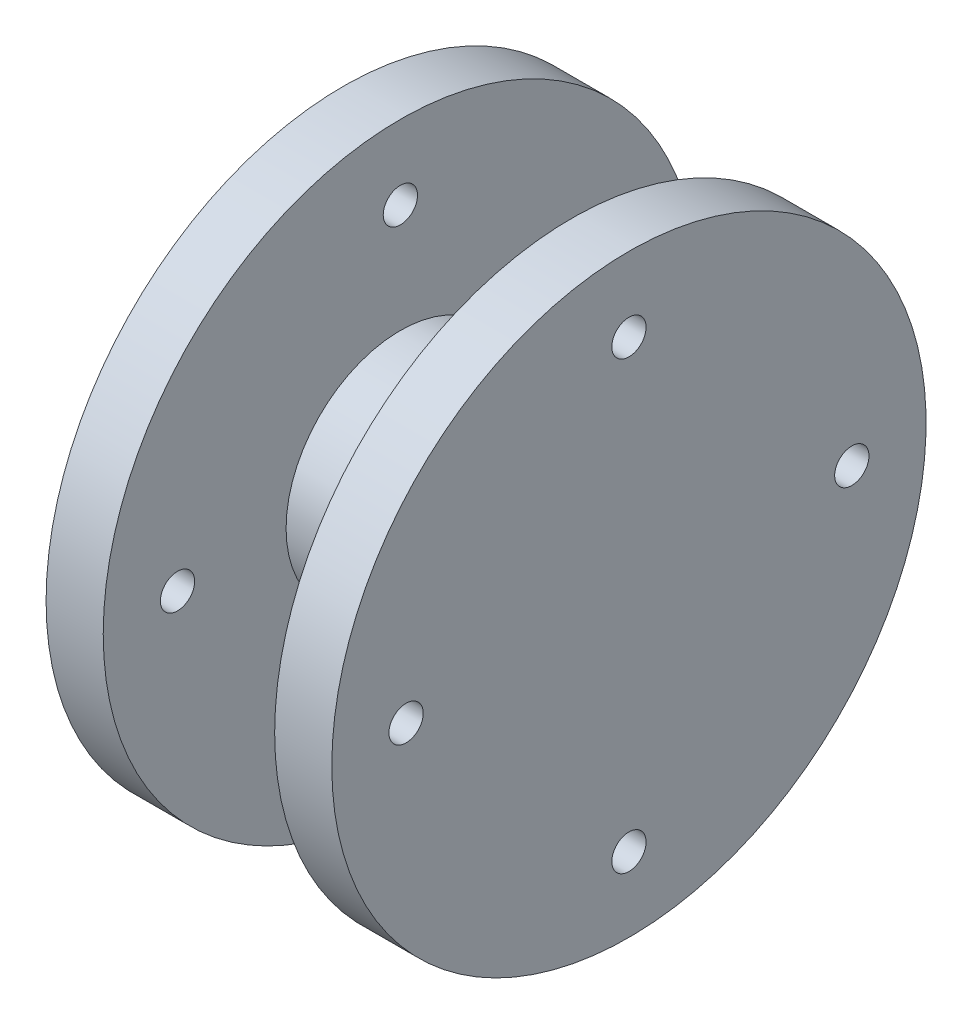
from build123d import *

# Parameters (mm, degrees)
SKETCH_2_R               = 1.5
CUT_EXTRUDE_1_DEPTH      = 45.463468151
PATTERN_CIRCULAR_1_COUNT = 4


with BuildPart() as part:
    # Эскиз1 → Повернуть1 (revolve)
    with BuildSketch(Plane.XY):
        Polygon((0, 0), (0, 26), (5, 26), (5, 10), (20, 10), (20, 26), (25, 26), (25, 0), align=None)
    revolve(axis=Axis((0, 0, 0), (1, 0, 0)))

    # Эскиз2 → Вырез-Вытянуть1 (cut, through all)
    with BuildSketch(Plane.ZY):
        with Locations((0, 19.5)):
            Circle(SKETCH_2_R)
    cut_extrude_1 = extrude(amount=-CUT_EXTRUDE_1_DEPTH, mode=Mode.SUBTRACT)

    # Круговой массив1: Вырез-Вытянуть1 ×4 about axis
    pattern_circular_1_axis = Axis((5, 0, 0), (-1, 0, 0))
    for i in range(1, PATTERN_CIRCULAR_1_COUNT):
        add(cut_extrude_1.rotate(pattern_circular_1_axis, i * 360 / PATTERN_CIRCULAR_1_COUNT), mode=Mode.SUBTRACT)


solid = part.part
